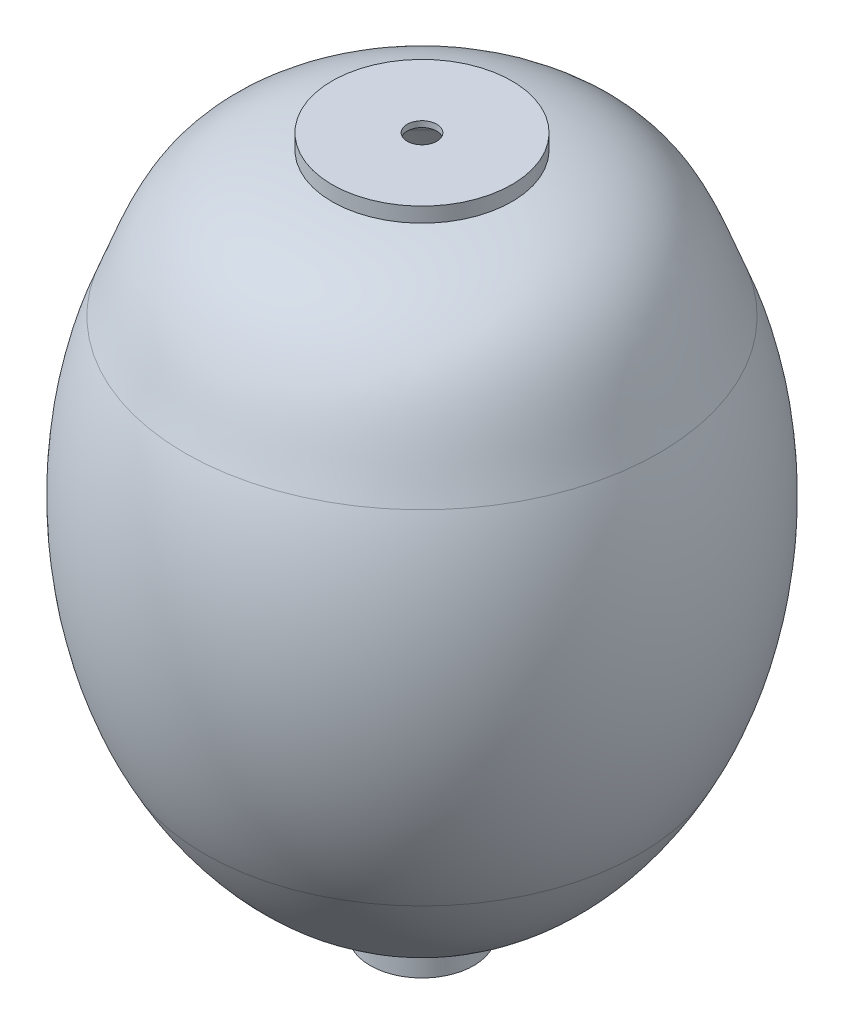
from build123d import *

# Parameters (mm, degrees)
SHELL3_T           = -2
SKETCH3_R          = 5
CUT_EXTRUDE1_DEPTH = 15


with BuildPart() as part:
    # Sketch2 → Revolve2 (revolve)
    with BuildSketch(Plane(origin=(0, 0, 0), x_dir=(-1, 0, 0), z_dir=(0, 0, -1)), mode=Mode.PRIVATE) as revolve2_sk:
        with BuildLine():
            Line((-17.5, -223), (-17.5, -235))
            Line((-17.5, -235), (0, -235))
            Line((0, -235), (0, 0))
            Line((0, 0), (-30.373412759, 0))
            Line((-30.373412759, 0), (-30.373412759, -5))
            add(Edge.make_bspline(
                [(-30.373412759, -5), (-68.255644441, -11.381606411), (-71.564160917, -32.457372842), (-80.088126346, -53.712485983)],
                knots=[0, 0, 0, 0, 0.756782794, 0.756782794, 0.756782794, 0.756782794], degree=3))
            add(Edge.make_bspline(
                [(-80.088126346, -53.712485983), (-80.710342488, -55.264026122), (-81.274185834, -56.765227602), (-82.314757199, -59.697080734), (-82.791229201, -61.127477869), (-83.674692355, -63.935939366), (-84.081567676, -65.313887223), (-84.837574886, -68.029814752), (-85.186648177, -69.367735659), (-85.835247655, -72.012486421), (-86.134742486, -73.31928851), (-86.690106047, -75.908455241), (-86.945956189, -77.190802562), (-87.654649192, -81.009003243), (-88.04899864, -83.516320185), (-88.704666889, -88.485364727), (-88.965816411, -90.946903422), (-89.217044092, -94.009045025), (-89.263499543, -94.620658382), (-89.348801959, -95.839675403), (-89.387681288, -96.447458164), (-89.493292417, -98.26613708), (-89.549008079, -99.472362876), (-89.673936304, -103.075951846), (-89.701072657, -105.458305613), (-89.649004485, -110.199418315), (-89.569775925, -112.558121163), (-89.306555096, -117.266391906), (-89.122563253, -119.615913096), (-88.647454668, -124.319902793), (-88.356362689, -126.674320786), (-87.660384993, -131.403215577), (-87.255558847, -133.777622363), (-86.319925745, -138.564374285), (-85.789242966, -140.976601149), (-85.034455165, -144.030180826), (-84.878899829, -144.642830623), (-84.558154932, -145.872454181), (-84.39286328, -146.489797739), (-83.882520752, -148.346418979), (-83.523603774, -149.588273009), (-82.764818824, -152.083959929), (-82.364963487, -153.337782339), (-81.519578677, -155.861985028), (-81.074069355, -157.132349205), (-80.131006956, -159.695439283), (-79.633487983, -160.988137809), (-78.577604706, -163.603556835), (-78.019301649, -164.926228518), (-76.829249806, -167.612203845), (-76.197620891, -168.975412371), (-74.890266263, -171.658896187), (-74.221119527, -172.975126744), (-73.499862727, -174.325526667)],
                knots=[422.815435377, 422.815435377, 422.815435377, 422.815435377, 427.264785818, 427.264785818, 431.714136259, 431.714136259, 436.1634867, 436.1634867, 440.612837142, 440.612837142, 445.062187583, 445.062187583, 449.511538024, 449.511538024, 458.410240575, 458.410240575, 467.308941457, 467.308941457, 469.533616678, 469.533616678, 471.758291899, 471.758291899, 476.20764234, 476.20764234, 485.106343222, 485.106343222, 494.005044104, 494.005044104, 502.903746656, 502.903746656, 511.802447538, 511.802447538, 520.70114842, 520.70114842, 529.599849303, 529.599849303, 531.824524523, 531.824524523, 534.049199744, 534.049199744, 538.498550185, 538.498550185, 542.947902295, 542.947902295, 547.397252736, 547.397252736, 551.846603177, 551.846603177, 556.295953618, 556.295953618, 560.74530406, 560.74530406, 564.877541763, 564.877541763, 564.877541763, 564.877541763], degree=3))
            add(Edge.make_bspline(
                [(-73.499862727, -174.325526667), (-70.70991814, -179.5491044), (-67.616272146, -184.537335562), (-62.470012801, -191.62773145), (-60.669793533, -193.925483291), (-56.882899322, -198.376497345), (-54.896355517, -200.529861179), (-51.757405659, -203.636589501), (-50.684484943, -204.651549362), (-49.031811401, -206.14044063), (-48.472875981, -206.631832772), (-47.344721225, -207.598804203), (-46.77557499, -208.074365155), (-43.903934935, -210.411663398), (-41.523876664, -212.152134702), (-36.57987058, -215.345580316), (-34.016504959, -216.799464839), (-30.684264043, -218.416649463), (-30.01138607, -218.730033913), (-28.65229928, -219.335961072), (-27.965662327, -219.628617074), (-24.077362229, -221.209232038), (-20.818815341, -222.242844297), (-17.5, -223)],
                knots=[0, 0, 0, 0, 0.25, 0.25, 0.375, 0.375, 0.5, 0.5, 0.5625, 0.5625, 0.59375, 0.59375, 0.625, 0.625, 0.75, 0.75, 0.875, 0.875, 0.90625, 0.90625, 0.9375, 0.9375, 1.082855067, 1.082855067, 1.082855067, 1.082855067], degree=3))
        make_face()
    revolve(revolve2_sk.sketch.rotate(Axis((0, 0, 0), (0, -1, 0)), 90), axis=Axis((0, 0, 0), (0, -1, 0)))

    # Shell3
    shell3_openings = [part.faces().sort_by_distance(p)[0] for p in [
        (0, -235, 0),
    ]]
    offset(amount=SHELL3_T, openings=shell3_openings, kind=Kind.INTERSECTION)

    # Sketch3 → Cut-Extrude1 (cut)
    with BuildSketch(Plane(origin=(0, 0, 0), x_dir=(1, 0, 0), z_dir=(0, 1, 0))):
        with Locations(Location((0, 0, 0), (0, 0, 270))):
            Circle(SKETCH3_R)
    extrude(amount=-CUT_EXTRUDE1_DEPTH, mode=Mode.SUBTRACT)


solid = part.part
